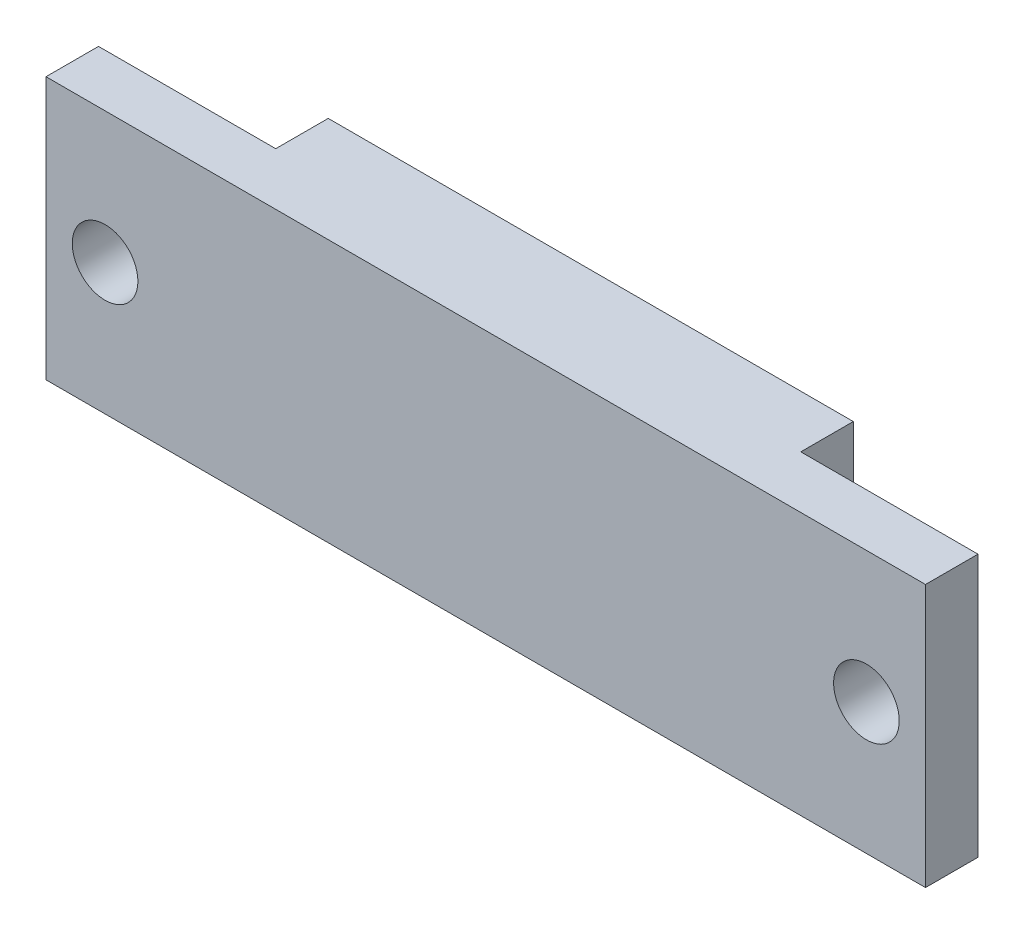
from build123d import *

# Parameters (mm, degrees)
BOSS_EXTRUDE1_DEPTH         = 25.4
F_1_4_0_25_DIAMETER_HOLE1_D = 6.35


with BuildPart() as part:
    # Sketch1 → Boss-Extrude1 (new body)
    with BuildSketch(Plane(origin=(0, 0, 0), x_dir=(1, 0, 0), z_dir=(0, 1, 0))):
        Polygon((67.945, 0), (85.09, 0), (85.09, -5.08), (0, -5.08), (0, 0), (17.145, 0), (17.145, 5.08), (67.945, 5.08), align=None)
    extrude(amount=BOSS_EXTRUDE1_DEPTH)

    # 1/4 (0.25) Diameter Hole1 (through all)
    with Locations(Plane.XY.offset(5.08)):
        with Locations((5.715, 12.7), (79.375, 12.7)):
            Hole(F_1_4_0_25_DIAMETER_HOLE1_D / 2)


solid = part.part
